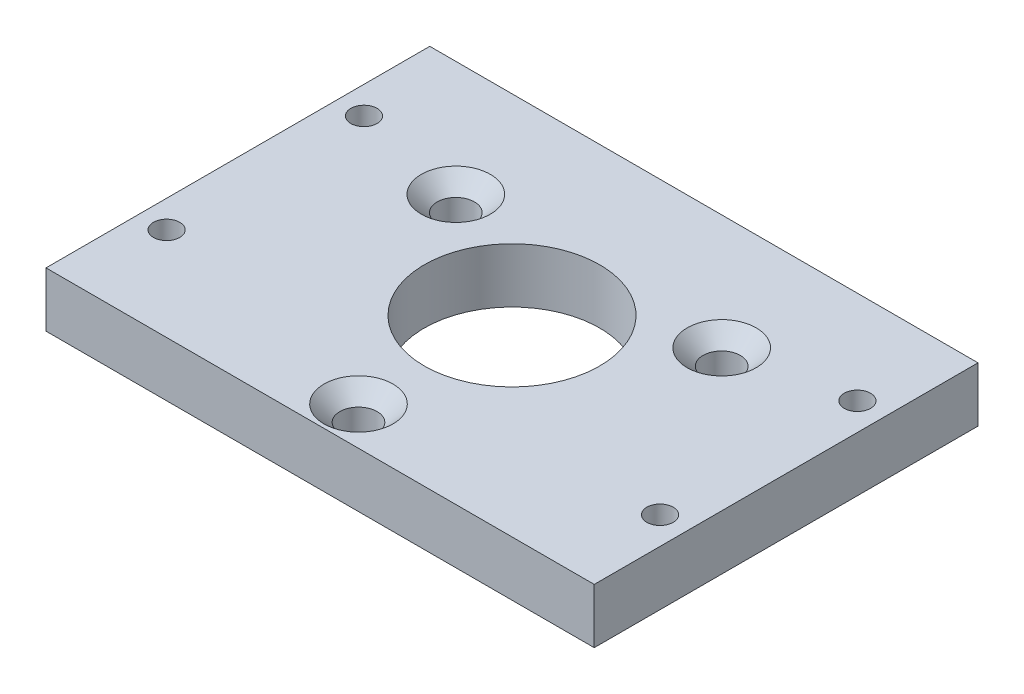
from build123d import *

# Parameters (mm, degrees)
SKETCH1_W                                           = 50
SKETCH1_H                                           = 35
SKETCH1_R                                           = 8
BOSS_EXTRUDE1_DEPTH                                 = 5
CSK_FOR_M3_COUNTERSUNK_FLAT_HEAD_SCREW1_D           = 3.4
CSK_FOR_M3_COUNTERSUNK_FLAT_HEAD_SCREW1_CSINK_D     = 6.3
CSK_FOR_M3_COUNTERSUNK_FLAT_HEAD_SCREW1_CSINK_ANGLE = 90
CSK_FOR_M2_COUNTERSUNK_FLAT_HEAD_SCREW1_D           = 2.4
CSK_FOR_M2_COUNTERSUNK_FLAT_HEAD_SCREW1_CSINK_D     = 4.4
CSK_FOR_M2_COUNTERSUNK_FLAT_HEAD_SCREW1_CSINK_ANGLE = 90


with BuildPart() as part:
    # Sketch1 → Boss-Extrude1 (new body)
    with BuildSketch(Plane(origin=(0, 0, 0), x_dir=(1, 0, 0), z_dir=(0, 1, 0))):
        Rectangle(SKETCH1_W, SKETCH1_H)
        with Locations(Location((0, 0, 0), (0, 0, 270))):
            Circle(SKETCH1_R, mode=Mode.SUBTRACT)
    extrude(amount=BOSS_EXTRUDE1_DEPTH)

    # CSK for M3 Countersunk Flat Head Screw1 (through all)
    with Locations(Plane(origin=(0, 5, 0), x_dir=(1, 0, 0), z_dir=(0, 1, 0))):
        with Locations((12.124355653, 7), (0, -14), (-12.124355653, 7)):
            CounterSinkHole(CSK_FOR_M3_COUNTERSUNK_FLAT_HEAD_SCREW1_D / 2, CSK_FOR_M3_COUNTERSUNK_FLAT_HEAD_SCREW1_CSINK_D / 2, counter_sink_angle=CSK_FOR_M3_COUNTERSUNK_FLAT_HEAD_SCREW1_CSINK_ANGLE)

    # CSK for M2 Countersunk Flat Head Screw1 (through all)
    with Locations(Plane(origin=(0, 0, 0), x_dir=(-1, 0, 0), z_dir=(0, -1, 0))):
        with Locations((22.5, -9), (22.5, 9), (-22.5, 9), (-22.5, -9)):
            CounterSinkHole(CSK_FOR_M2_COUNTERSUNK_FLAT_HEAD_SCREW1_D / 2, CSK_FOR_M2_COUNTERSUNK_FLAT_HEAD_SCREW1_CSINK_D / 2, counter_sink_angle=CSK_FOR_M2_COUNTERSUNK_FLAT_HEAD_SCREW1_CSINK_ANGLE)


solid = part.part
